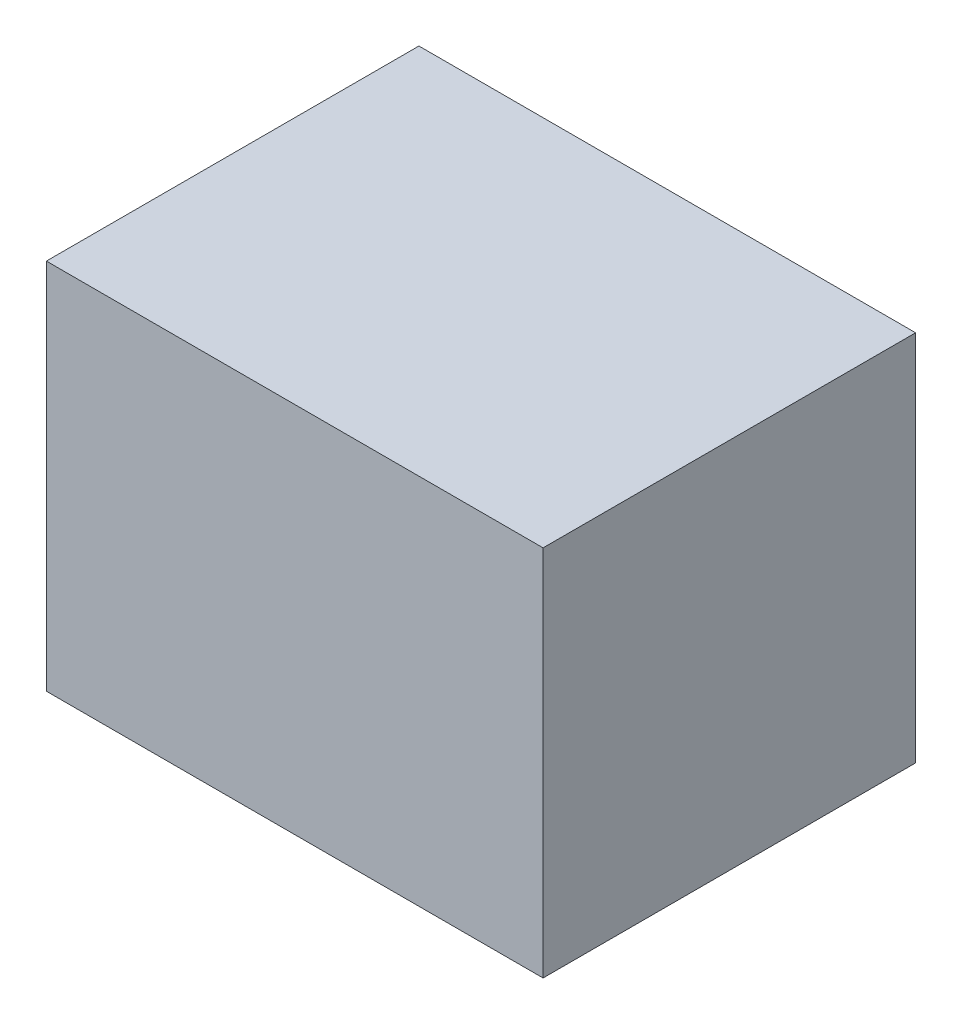
from build123d import *

# Parameters (mm, degrees)
SKETCH1_W           = 400
SKETCH1_H           = 300
BOSS_EXTRUDE1_DEPTH = 300
SHELL1_T            = 15


with BuildPart() as part:
    # Sketch1 → Boss-Extrude1 (new body)
    with BuildSketch(Plane.XY):
        with Locations((200, 150)):
            Rectangle(SKETCH1_W, SKETCH1_H)
    extrude(amount=BOSS_EXTRUDE1_DEPTH)

    # Shell1 (no face opened: a closed hollow body)
    add(offset(amount=-SHELL1_T, mode=Mode.PRIVATE), mode=Mode.SUBTRACT)


solid = part.part
